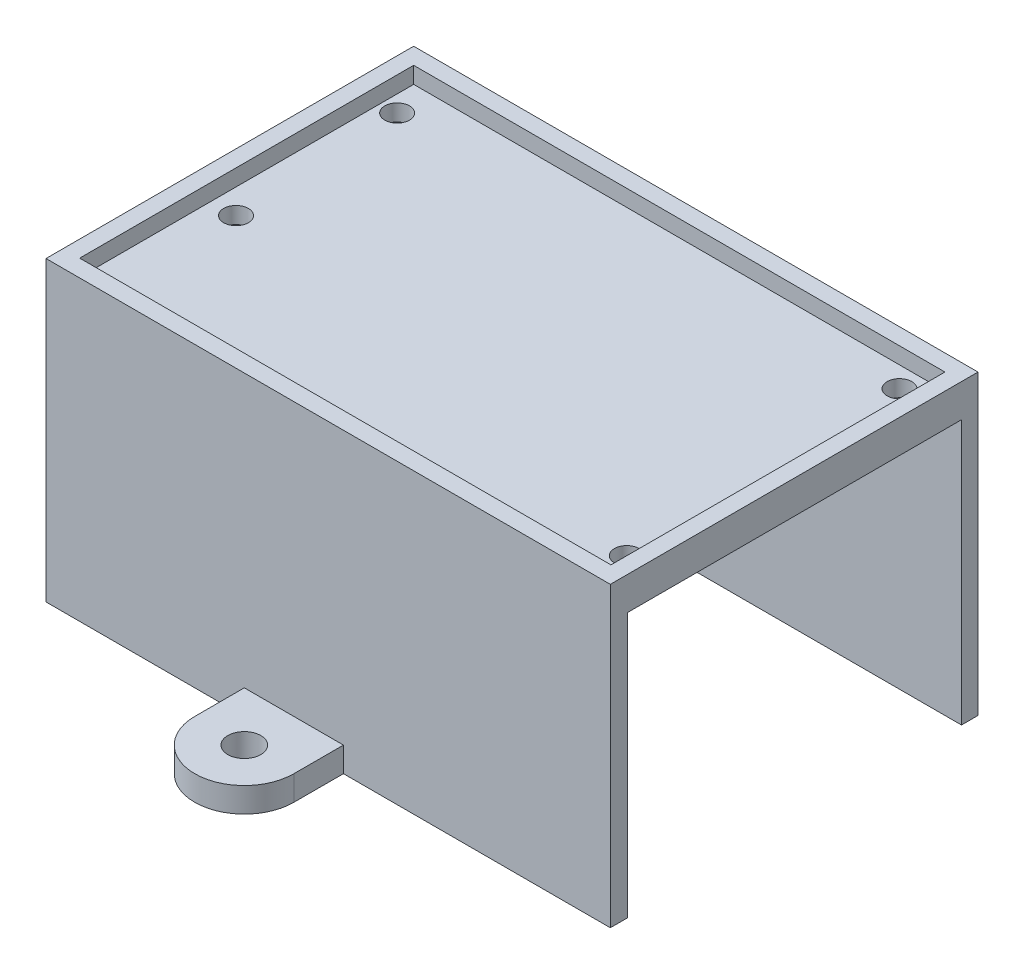
from build123d import *

# Parameters (mm, degrees)
SKETCH1_W                = 64.3
SKETCH1_H                = 40.5
SKETCH1_R                = 1.5
BOSS_EXTRUDE1_DEPTH      = 2
SKETCH1_3_W              = 68.3
SKETCH1_3_H              = 44.5
SKETCH1_3_W_2            = 64.3
SKETCH1_3_H_2            = 40.5
BOSS_EXTRUDE2_DEPTH      = 4
BOSS_EXTRUDE3_DEPTH      = 32
BOSS_EXTRUDE3_DEPTH_BACK = 4
SKETCH5_R                = 2
BOSS_EXTRUDE4_DEPTH      = 3


with BuildPart() as part:
    # Sketch1 → Boss-Extrude1 (new body)
    with BuildSketch(Plane(origin=(0, 0, 0), x_dir=(1, 0, 0), z_dir=(0, 1, 0))):
        with Locations((2.688909091, -7.273090909)):
            Rectangle(SKETCH1_W, SKETCH1_H)
        with Locations((-26.461090909, -11.523090909)):
            Circle(SKETCH1_R, mode=Mode.SUBTRACT)
        with Locations((32.838909091, -23.523090909)):
            Circle(SKETCH1_R, mode=Mode.SUBTRACT)
        with Locations((-27.461090909, 8.976909091)):
            Circle(SKETCH1_R, mode=Mode.SUBTRACT)
        with Locations((31.838909091, 10.476909091)):
            Circle(SKETCH1_R, mode=Mode.SUBTRACT)
    extrude(amount=BOSS_EXTRUDE1_DEPTH)

    # Sketch1<3> → Boss-Extrude2 (add)
    with BuildSketch(Plane(origin=(0, 0, 0), x_dir=(1, 0, 0), z_dir=(0, 1, 0))):
        with Locations((2.688909091, -7.273090909)):
            Rectangle(SKETCH1_3_W, SKETCH1_3_H)
        with Locations((2.688909091, -7.273090909)):
            Rectangle(SKETCH1_3_W_2, SKETCH1_3_H_2, mode=Mode.SUBTRACT)
    extrude(amount=BOSS_EXTRUDE2_DEPTH)

    # Sketch3 → Boss-Extrude3 (add, two sides: drawn at the far end of the back side and taken through both)
    with BuildSketch(Plane.XZ.offset(-BOSS_EXTRUDE3_DEPTH_BACK)):
        Polygon((-31.461090909, -14.976909091), (36.838909091, -14.976909091), (36.838909091, -12.977521958), (-29.461090909, -12.977521958), (-29.461090909, 27.446996909), (36.838909091, 27.446996909), (36.838909091, 29.523090909), (-31.461090909, 29.523090909), align=None)
    extrude(amount=BOSS_EXTRUDE3_DEPTH + BOSS_EXTRUDE3_DEPTH_BACK)

    # Sketch5 → Boss-Extrude4 (add)
    # profile 1 of 2: a face of its own
    with BuildSketch(Plane.XZ.offset(32)):
        with BuildLine():
            Line((-7.461090909, -12.977521958), (-7.461090909, -21.053615958))
            ThreePointArc((-7.461090909, -21.053615958), (-1.461090909, -27.053615958), (4.538909091, -21.053615958))
            Line((4.538909091, -21.053615958), (4.538909091, -12.977521958))
            Line((4.538909091, -12.977521958), (-7.461090909, -12.977521958))
        make_face()
        with Locations((-1.461090909, -21.053615958)):
            Circle(SKETCH5_R, mode=Mode.SUBTRACT)
    # profile 2 of 2: a face of its own
    with BuildSketch(Plane.XZ.offset(32)):
        with BuildLine():
            ThreePointArc((4.538909091, 35.523090909), (-1.461090909, 41.523090909), (-7.461090909, 35.523090909))
            Line((-7.461090909, 35.523090909), (-7.461090909, 29.523090909))
            Line((-7.461090909, 29.523090909), (4.538909091, 29.523090909))
            Line((4.538909091, 29.523090909), (4.538909091, 35.523090909))
        make_face()
        with Locations((-1.461090909, 35.523090909)):
            Circle(SKETCH5_R, mode=Mode.SUBTRACT)
    extrude(amount=-BOSS_EXTRUDE4_DEPTH)


solid = part.part
